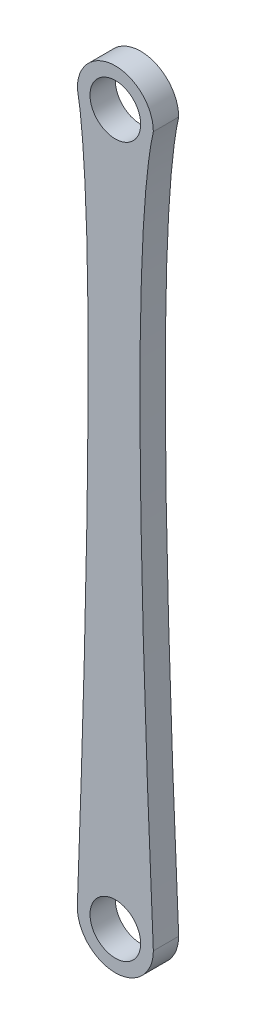
from build123d import *

# Parameters (mm, degrees)
SKETCH1_R           = 10
BOSS_EXTRUDE1_DEPTH = 10


with BuildPart() as part:
    # Sketch1 → Boss-Extrude1 (new body)
    with BuildSketch(Plane.XY):
        with BuildLine():
            ThreePointArc((-15, -75.267843328), (0, -90.267843328), (15, -75.267843328))
            add(Edge.make_bspline(
                [(15, 204.732156672), (4.423835308, 157.931962062), (15, -75.267843328)],
                knots=[0, 0, 0, 1, 1, 1], degree=2))
            ThreePointArc((15, 204.732156672), (0, 219.732156672), (-15, 204.732156672))
            add(Edge.make_bspline(
                [(-15, 204.732156672), (-6.422661748, 158.481211522), (-15, -75.267843328)],
                knots=[0, 0, 0, 1, 1, 1], degree=2))
        make_face()
        with Locations((0, -75.267843328)):
            Circle(SKETCH1_R, mode=Mode.SUBTRACT)
        with Locations((0, 204.732156672)):
            Circle(SKETCH1_R, mode=Mode.SUBTRACT)
    extrude(amount=BOSS_EXTRUDE1_DEPTH)


solid = part.part
